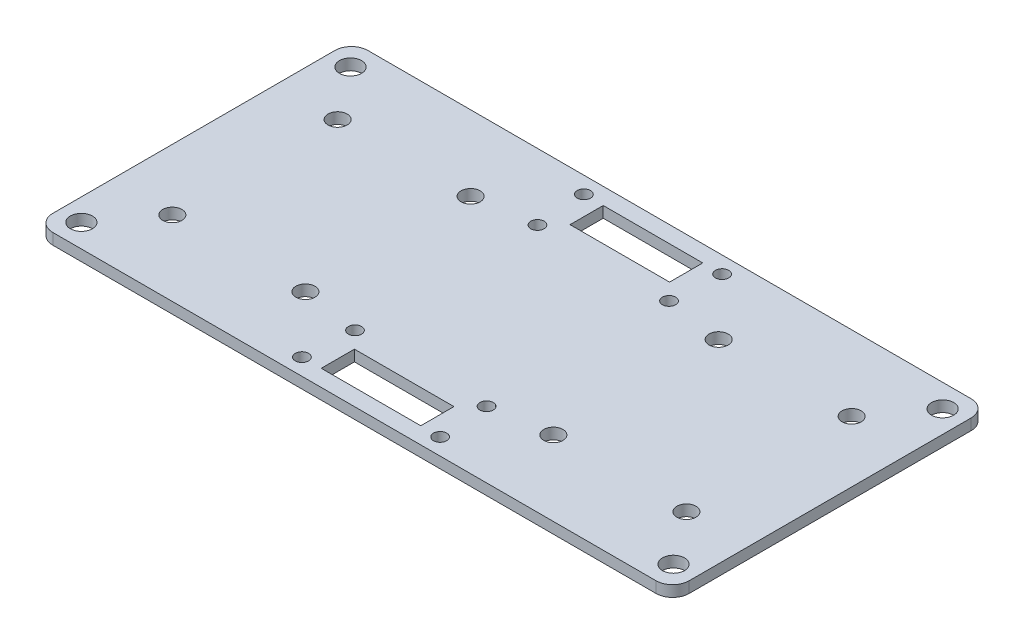
from build123d import *

# Parameters (mm, degrees)
ESBO_O1_W                = 115.09677689
ESBO_O1_H                = 57
RESSALTO_EXTRUS_O1_DEPTH = 2
ESBO_O2_R                = 1.73
CORTE_EXTRUS_O1_DEPTH    = 65.699822354
ESBO_O3_W                = 18
ESBO_O3_H                = 6
CORTE_EXTRUS_O2_DEPTH    = 65.699822354
ESBO_O5_R                = 2
CORTE_EXTRUS_O3_DEPTH    = 65.699822354
FILETE1_R                = 3
ESBO_O8_R                = 1.2
CORTE_EXTRUS_O4_DEPTH    = 65.699822354


with BuildPart() as part:
    # Esboço1 → Ressalto-extrusão1 (new body)
    with BuildSketch(Plane(origin=(0, 0, 0), x_dir=(1, 0, 0), z_dir=(0, 1, 0))):
        with Locations((0, 1)):
            Rectangle(ESBO_O1_W, ESBO_O1_H)
    extrude(amount=RESSALTO_EXTRUS_O1_DEPTH)

    # Esboço2 → Corte-extrusão1 (cut, through all)
    with BuildSketch(Plane(origin=(0, 2, 0), x_dir=(1, 0, 0), z_dir=(0, 1, 0))):
        with Locations(Location((-46.488388445, 15.945, 0), (0, 0, 270))):
            Circle(ESBO_O2_R)
        with Locations(Location((-22.428388445, 15.945, 0), (0, 0, 270))):
            Circle(ESBO_O2_R)
        with Locations(Location((-22.428388445, -13.945, 0), (0, 0, 270))):
            Circle(ESBO_O2_R)
        with Locations(Location((22.428388445, -13.945, 0), (0, 0, 90))):
            Circle(ESBO_O2_R)
        with Locations(Location((22.428388445, 15.945, 0), (0, 0, 90))):
            Circle(ESBO_O2_R)
        with Locations(Location((46.488388445, 15.945, 0), (0, 0, 90))):
            Circle(ESBO_O2_R)
        with Locations(Location((-46.488388445, -13.945, 0), (0, 0, 270))):
            Circle(ESBO_O2_R)
        with Locations(Location((46.488388445, -13.945, 0), (0, 0, 90))):
            Circle(ESBO_O2_R)
    extrude(amount=-CORTE_EXTRUS_O1_DEPTH, mode=Mode.SUBTRACT)

    # Esboço3 → Corte-extrusão2 (cut, through all)
    with BuildSketch(Plane.XZ):
        with Locations((0, 21.5)):
            Rectangle(ESBO_O3_W, ESBO_O3_H)
        with Locations((0, -23.5)):
            Rectangle(ESBO_O3_W, ESBO_O3_H)
    extrude(amount=-CORTE_EXTRUS_O2_DEPTH, mode=Mode.SUBTRACT)

    # Esboço5 → Corte-extrusão3 (cut, through all)
    with BuildSketch(Plane(origin=(0, 2, 0), x_dir=(1, 0, 0), z_dir=(0, 1, 0))):
        with Locations(Location((53.548388445, 25.3375, 0), (0, 0, 270))):
            Circle(ESBO_O5_R)
        with Locations(Location((53.548388445, -23.3375, 0), (0, 0, 90))):
            Circle(ESBO_O5_R)
        with Locations(Location((-53.548388445, -23.3375, 0), (0, 0, 270))):
            Circle(ESBO_O5_R)
        with Locations(Location((-53.548388445, 25.3375, 0), (0, 0, 90))):
            Circle(ESBO_O5_R)
    extrude(amount=-CORTE_EXTRUS_O3_DEPTH, mode=Mode.SUBTRACT)

    # Filete1
    filete1_edges = [part.edges().sort_by_distance(p)[0] for p in [
        (-57.548388445, 1, -29.5),
        (57.548388445, 1, -29.5),
        (57.548388445, 1, 27.5),
        (-57.548388445, 1, 27.5),
    ]]
    fillet(filete1_edges, radius=FILETE1_R)

    # Esboço8 → Corte-extrusão4 (cut, through all)
    with BuildSketch(Plane(origin=(0, 2, 0), x_dir=(1, 0, 0), z_dir=(0, 1, 0))):
        with Locations(Location((-12.498388445, 26.5, 0), (0, 0, 270))):
            Circle(ESBO_O8_R)
        with Locations(Location((12.498388445, 26.5, 0), (0, 0, 90))):
            Circle(ESBO_O8_R)
        with Locations(Location((12.498388445, -24.5, 0), (0, 0, 270))):
            Circle(ESBO_O8_R)
        with Locations(Location((-12.498388445, -24.5, 0), (0, 0, 90))):
            Circle(ESBO_O8_R)
        with Locations(Location((-11.898388445, 17.5, 0), (0, 0, 270))):
            Circle(ESBO_O8_R)
        with Locations(Location((11.898388445, 17.5, 0), (0, 0, 90))):
            Circle(ESBO_O8_R)
        with Locations(Location((11.898388445, -15.5, 0), (0, 0, 270))):
            Circle(ESBO_O8_R)
        with Locations(Location((-11.898388445, -15.5, 0), (0, 0, 90))):
            Circle(ESBO_O8_R)
    extrude(amount=-CORTE_EXTRUS_O4_DEPTH, mode=Mode.SUBTRACT)


solid = part.part
